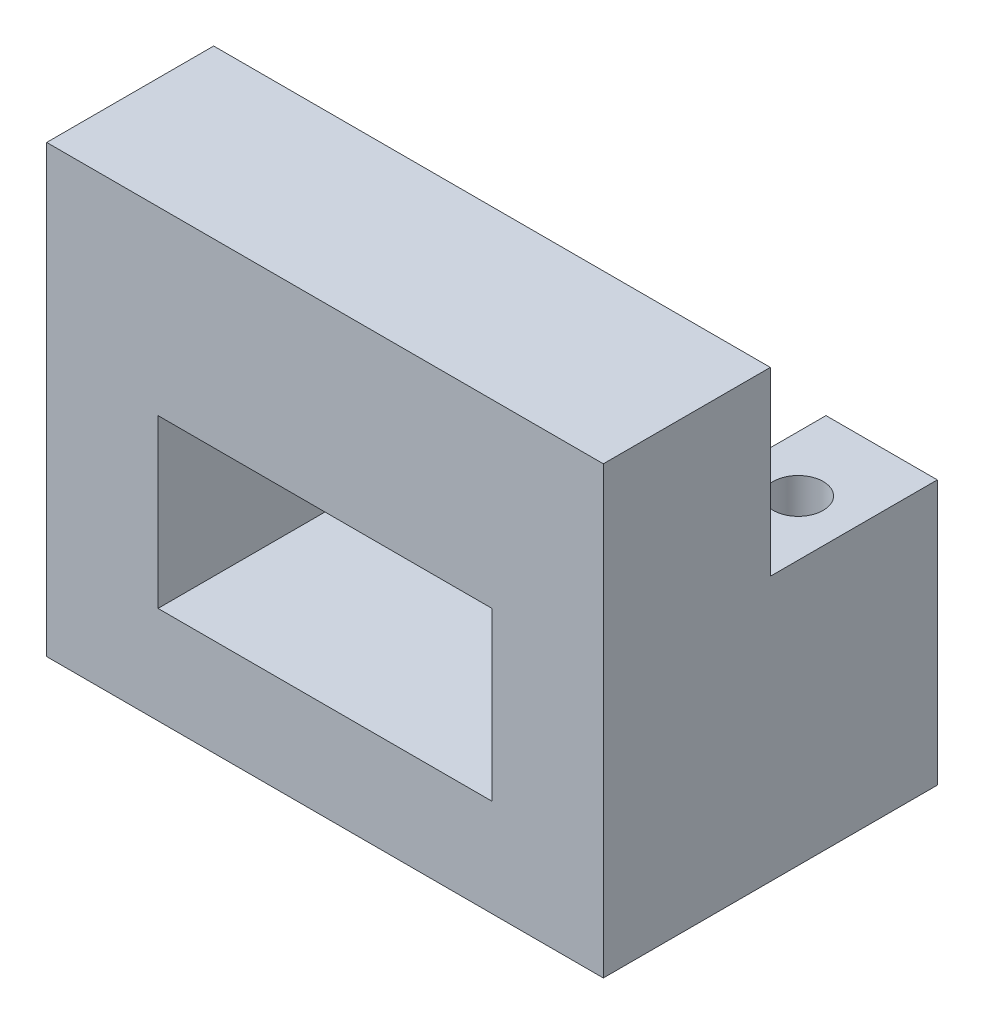
from build123d import *

# Parameters (mm, degrees)
SKETCH_1_W          = 100
SKETCH_1_H          = 80
EXTRUDE_1_DEPTH     = 15
SKETCH_4_W          = 100
SKETCH_4_H          = 47.5
EXTRUDE_2_DEPTH     = 30
SKETCH_2_W          = 60
SKETCH_2_H          = 30
CUT_EXTRUDE_1_DEPTH = 54.5
SKETCH_5_R          = 4.5
CUT_EXTRUDE_2_DEPTH = 105.522724802


with BuildPart() as part:
    # 草图1 → 凸台-拉伸1 (new, symmetric)
    with BuildSketch(Plane.XY):
        Rectangle(SKETCH_1_W, SKETCH_1_H)
    extrude(amount=EXTRUDE_1_DEPTH, both=True)

    # 草图4 → 凸台-拉伸2 (add)
    with BuildSketch(Plane.XY.offset(-15)):
        with Locations((0, -16.25)):
            Rectangle(SKETCH_4_W, SKETCH_4_H)
    extrude(amount=-EXTRUDE_2_DEPTH)

    # 草图2 → 切除-拉伸1 (cut, symmetric)
    with BuildSketch(Plane(origin=(0, 0, -15), x_dir=(-1, 0, 0), z_dir=(0, 0, -1))):
        with Locations((0, -7.5)):
            Rectangle(SKETCH_2_W, SKETCH_2_H)
    extrude(amount=CUT_EXTRUDE_1_DEPTH, both=True, mode=Mode.SUBTRACT)

    # 草图5 → 切除-拉伸2 (cut, through all)
    with BuildSketch(Plane.XZ.offset(40)):
        with Locations(Location((-40, -30, 0), (0, 0, 270))):
            Circle(SKETCH_5_R)
        with Locations(Location((40, -30, 0), (0, 0, 270))):
            Circle(SKETCH_5_R)
    extrude(amount=-CUT_EXTRUDE_2_DEPTH, mode=Mode.SUBTRACT)


solid = part.part
